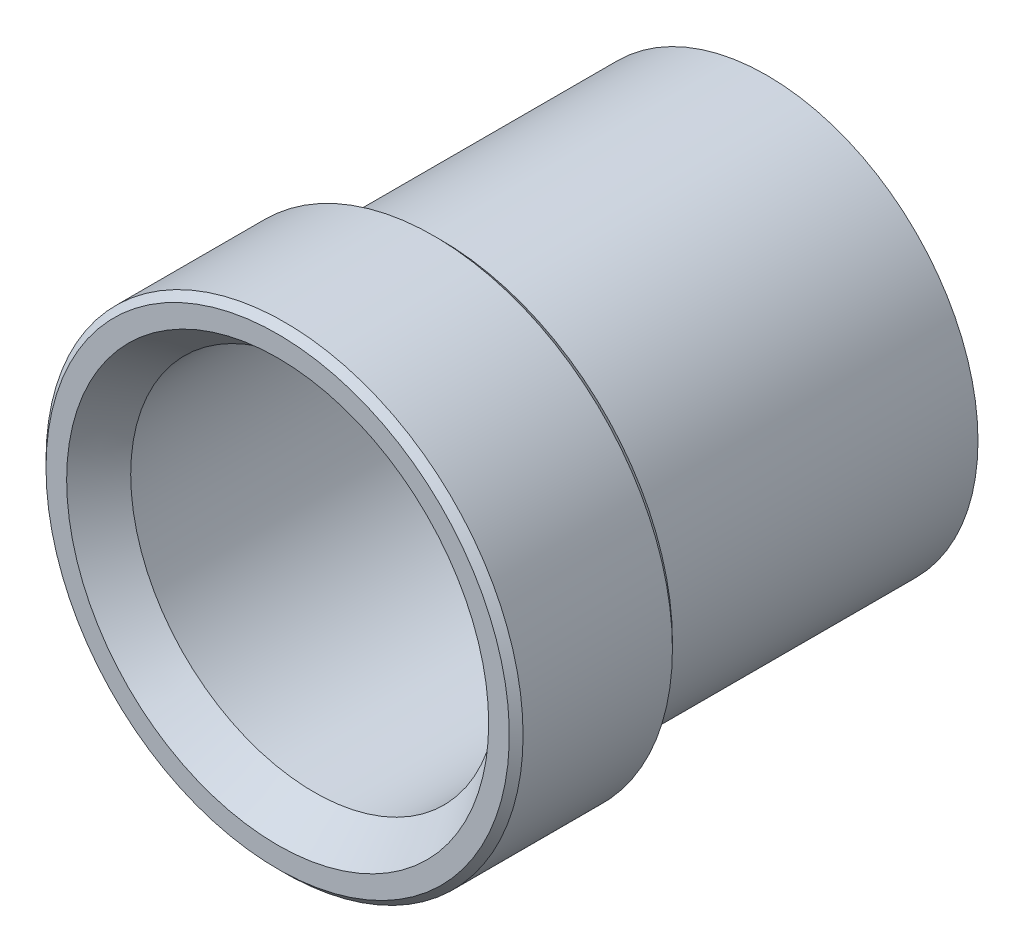
from build123d import *

# Parameters (mm, degrees)
CHAMFER1_SIZE = 0.17859375


with BuildPart() as part:
    # Sketch2 → Revolve1 (revolve)
    with BuildSketch(Plane(origin=(0, 0, 0), x_dir=(0, 0, -1), z_dir=(1, 0, 0)), mode=Mode.PRIVATE) as revolve1_sk:
        Polygon((-5.401992356, 4.7625), (-6.35, 5.476875), (-6.35, 6.19125), (-2.116666667, 6.19125), (-2.116666667, 5.476875), (6.35, 5.476875), (6.35, 4.7625), align=None)
    revolve(revolve1_sk.sketch.rotate(Axis((0, 0, 6.35), (0, 0, -1)), 90), axis=Axis((0, 0, 6.35), (0, 0, -1)))

    # Chamfer1
    chamfer1_edges = [part.edges().sort_by_distance(p)[0] for p in [
        (-6.19125, 0, 2.116666667),
        (-6.19125, 0, 6.35),
    ]]
    chamfer(chamfer1_edges, length=CHAMFER1_SIZE)


solid = part.part
